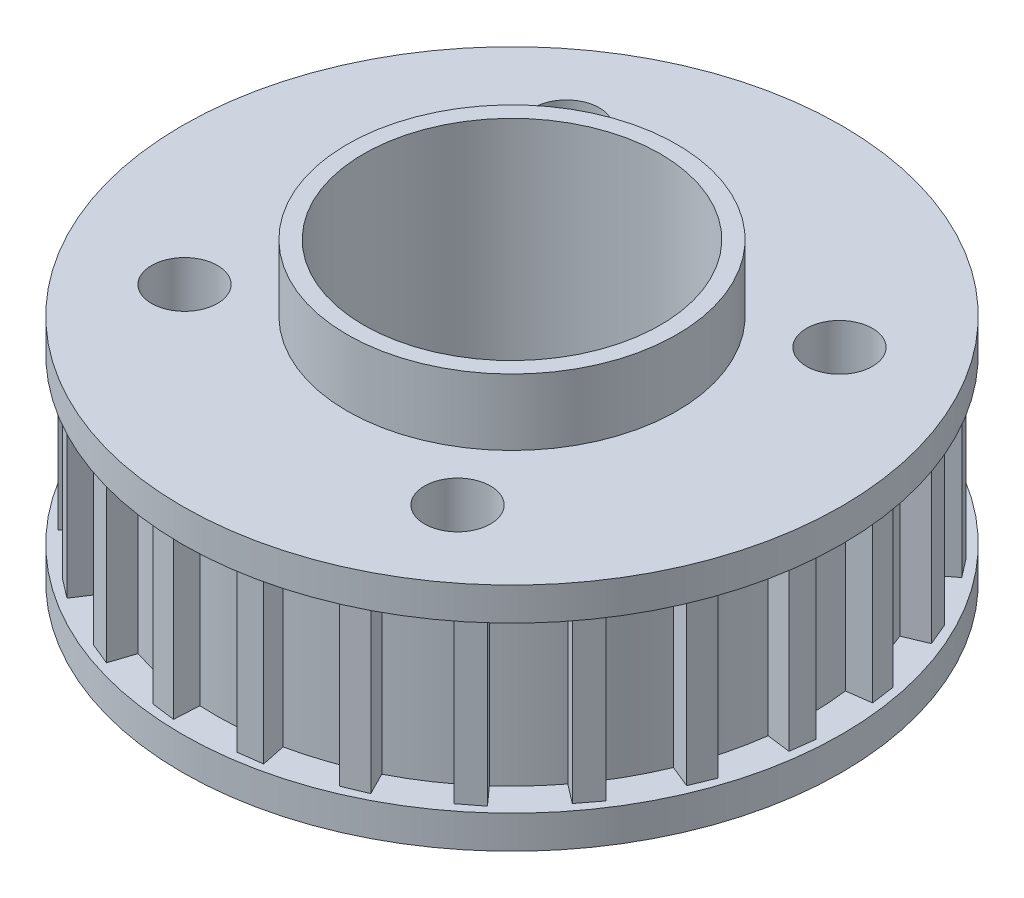
from build123d import *

# Parameters (mm, degrees)
SKETCH1_R           = 31.75
SKETCH1_R_2         = 14.2875
BOSS_EXTRUDE1_DEPTH = 3.175
SKETCH2_R           = 15.875
SKETCH2_R_2         = 14.2875
BOSS_EXTRUDE2_DEPTH = 25.4
SKETCH3_R           = 3.175
CUT_EXTRUDE1_DEPTH  = 25.4
BOSS_EXTRUDE3_START = 15.8496
SKETCH4_R           = 3.175
SKETCH4_R_2         = 15.875
BOSS_EXTRUDE3_DEPTH = 15.8496
BOSS_EXTRUDE4_START = 15.875
BOSS_EXTRUDE4_DEPTH = 15.875
BOSS_EXTRUDE5_START = 3.175
SKETCH5_R           = 31.75
SKETCH5_R_2         = 15.875
SKETCH5_R_3         = 3.175
BOSS_EXTRUDE5_DEPTH = 3.175


with BuildPart() as part:
    # Sketch1 → Boss-Extrude1 (new body)
    with BuildSketch(Plane(origin=(0, 0, 0), x_dir=(1, 0, 0), z_dir=(0, 1, 0))):
        Circle(SKETCH1_R)
        Circle(SKETCH1_R_2, mode=Mode.SUBTRACT)
    extrude(amount=BOSS_EXTRUDE1_DEPTH)

    # Sketch2 → Boss-Extrude2 (add)
    with BuildSketch(Plane(origin=(0, 3.175, 0), x_dir=(1, 0, 0), z_dir=(0, 1, 0))):
        Circle(SKETCH2_R)
        Circle(SKETCH2_R_2, mode=Mode.SUBTRACT)
    extrude(amount=BOSS_EXTRUDE2_DEPTH)

    # Sketch3 → Cut-Extrude1 (cut)
    with BuildSketch(Plane(origin=(0, 3.175, 0), x_dir=(1, 0, 0), z_dir=(0, 1, 0))):
        with Locations((-18.390705049, -13.145843594)):
            Circle(SKETCH3_R)
        with Locations((-13.145843594, 18.390705049)):
            Circle(SKETCH3_R)
        with Locations((18.390705049, 13.145843594)):
            Circle(SKETCH3_R)
        with Locations((13.145843594, -18.390705049)):
            Circle(SKETCH3_R)
    extrude(amount=-CUT_EXTRUDE1_DEPTH, mode=Mode.SUBTRACT)

    # Sketch4 → Boss-Extrude3 (add)
    with BuildSketch(Plane(origin=(0, 3.175, 0), x_dir=(1, 0, 0), z_dir=(0, 1, 0)).offset(BOSS_EXTRUDE3_START)):
        with BuildLine():
            ThreePointArc((-15.593126517, -23.927184529), (-13.286641881, -25.280840603), (-10.863650415, -26.412816089))
            ThreePointArc((-10.863650415, -26.412816089), (-9.873160958, -26.798814279), (-8.868992564, -27.147683603))
            ThreePointArc((-8.868992564, -27.147683603), (-6.290747513, -27.858252813), (-3.657340665, -28.324540832))
            ThreePointArc((-3.657340665, -28.324540832), (-2.600697634, -28.441028918), (-1.540451424, -28.518112902))
            ThreePointArc((-1.540451424, -28.518112902), (1.133850902, -28.537171132), (3.798210807, -28.305994926))
            ThreePointArc((3.798210807, -28.305994926), (4.848998935, -28.145034436), (5.893068935, -27.945079936))
            ThreePointArc((5.893068935, -27.945079936), (8.481179251, -27.271328398), (10.99492049, -26.358442244))
            ThreePointArc((10.99492049, -26.358442244), (11.96824424, -25.93100237), (12.924986385, -25.467635953))
            ThreePointArc((12.924986385, -25.467635953), (15.250529251, -24.146989701), (17.442344511, -22.614605282))
            ThreePointArc((17.442344511, -22.614605282), (18.271873478, -21.949815345), (19.076087372, -21.254614667))
            ThreePointArc((19.076087372, -21.254614667), (20.980580885, -19.377073562), (22.701101578, -17.329620342))
            ThreePointArc((22.701101578, -17.329620342), (23.330304735, -16.472784678), (23.927184529, -15.593126517))
            ThreePointArc((23.927184529, -15.593126517), (25.280840603, -13.286641881), (26.412816089, -10.863650415))
            ThreePointArc((26.412816089, -10.863650415), (26.798814279, -9.873160958), (27.147683603, -8.868992564))
            ThreePointArc((27.147683603, -8.868992564), (27.858252813, -6.290747513), (28.324540832, -3.657340665))
            ThreePointArc((28.324540832, -3.657340665), (28.441028918, -2.600697634), (28.518112902, -1.540451424))
            ThreePointArc((28.518112902, -1.540451424), (28.549292011, -0.770506171), (28.55968757, 0))
            ThreePointArc((28.55968757, 0), (28.496193829, 1.903336892), (28.305994926, 3.798210807))
            ThreePointArc((28.305994926, 3.798210807), (28.145034436, 4.848998935), (27.945079936, 5.893068935))
            ThreePointArc((27.945079936, 5.893068935), (27.271328398, 8.481179251), (26.358442244, 10.99492049))
            ThreePointArc((26.358442244, 10.99492049), (25.93100237, 11.96824424), (25.467635953, 12.924986385))
            ThreePointArc((25.467635953, 12.924986385), (24.146989701, 15.250529251), (22.614605282, 17.442344511))
            ThreePointArc((22.614605282, 17.442344511), (21.949815345, 18.271873478), (21.254614667, 19.076087372))
            ThreePointArc((21.254614667, 19.076087372), (19.377073562, 20.980580885), (17.329620342, 22.701101578))
            ThreePointArc((17.329620342, 22.701101578), (16.472784678, 23.330304735), (15.593126517, 23.927184529))
            ThreePointArc((15.593126517, 23.927184529), (13.286641881, 25.280840603), (10.863650415, 26.412816089))
            ThreePointArc((10.863650415, 26.412816089), (9.873160958, 26.798814279), (8.868992564, 27.147683603))
            ThreePointArc((8.868992564, 27.147683603), (6.290747513, 27.858252813), (3.657340665, 28.324540832))
            ThreePointArc((3.657340665, 28.324540832), (2.600697634, 28.441028918), (1.540451424, 28.518112902))
            ThreePointArc((1.540451424, 28.518112902), (-1.133850902, 28.537171132), (-3.798210807, 28.305994926))
            ThreePointArc((-3.798210807, 28.305994926), (-4.848998935, 28.145034436), (-5.893068935, 27.945079936))
            ThreePointArc((-5.893068935, 27.945079936), (-8.481179251, 27.271328398), (-10.99492049, 26.358442244))
            ThreePointArc((-10.99492049, 26.358442244), (-11.96824424, 25.93100237), (-12.924986385, 25.467635953))
            ThreePointArc((-12.924986385, 25.467635953), (-15.250529251, 24.146989701), (-17.442344511, 22.614605282))
            ThreePointArc((-17.442344511, 22.614605282), (-18.271873478, 21.949815345), (-19.076087372, 21.254614667))
            ThreePointArc((-19.076087372, 21.254614667), (-20.980580885, 19.377073562), (-22.701101578, 17.329620342))
            ThreePointArc((-22.701101578, 17.329620342), (-23.330304735, 16.472784678), (-23.927184529, 15.593126517))
            ThreePointArc((-23.927184529, 15.593126517), (-25.280840603, 13.286641881), (-26.412816089, 10.863650415))
            ThreePointArc((-26.412816089, 10.863650415), (-26.798814279, 9.873160958), (-27.147683603, 8.868992564))
            ThreePointArc((-27.147683603, 8.868992564), (-27.858252813, 6.290747513), (-28.324540832, 3.657340665))
            ThreePointArc((-28.324540832, 3.657340665), (-28.441028918, 2.600697634), (-28.518112902, 1.540451424))
            ThreePointArc((-28.518112902, 1.540451424), (-28.537171132, -1.133850902), (-28.305994926, -3.798210807))
            ThreePointArc((-28.305994926, -3.798210807), (-28.145034436, -4.848998935), (-27.945079936, -5.893068935))
            ThreePointArc((-27.945079936, -5.893068935), (-27.271328398, -8.481179251), (-26.358442244, -10.99492049))
            ThreePointArc((-26.358442244, -10.99492049), (-25.93100237, -11.96824424), (-25.467635953, -12.924986385))
            ThreePointArc((-25.467635953, -12.924986385), (-24.146989701, -15.250529251), (-22.614605282, -17.442344511))
            ThreePointArc((-22.614605282, -17.442344511), (-21.949815345, -18.271873478), (-21.254614667, -19.076087372))
            ThreePointArc((-21.254614667, -19.076087372), (-19.377073562, -20.980580885), (-17.329620342, -22.701101578))
            ThreePointArc((-17.329620342, -22.701101578), (-16.472784678, -23.330304735), (-15.593126517, -23.927184529))
        make_face()
        with Locations((-18.390705049, -13.145843594)):
            Circle(SKETCH4_R, mode=Mode.SUBTRACT)
        with Locations((13.145843594, -18.390705049)):
            Circle(SKETCH4_R, mode=Mode.SUBTRACT)
        Circle(SKETCH4_R_2, mode=Mode.SUBTRACT)
        with Locations((-13.145843594, 18.390705049)):
            Circle(SKETCH4_R, mode=Mode.SUBTRACT)
        with Locations((18.390705049, 13.145843594)):
            Circle(SKETCH4_R, mode=Mode.SUBTRACT)
    extrude(amount=-BOSS_EXTRUDE3_DEPTH)

    # Sketch4<9> → Boss-Extrude4 (add)
    with BuildSketch(Plane(origin=(0, 3.175, 0), x_dir=(1, 0, 0), z_dir=(0, 1, 0)).offset(BOSS_EXTRUDE4_START)):
        with BuildLine():
            ThreePointArc((-8.868992564, -27.147683603), (-9.873160958, -26.798814279), (-10.863650415, -26.412816089))
            Line((-10.863650415, -26.412816089), (-11.746663464, -28.55968757))
            Line((-11.746663464, -28.55968757), (-9.616514462, -29.435822625))
            Line((-9.616514462, -29.435822625), (-8.868992564, -27.147683603))
        make_face()
        with BuildLine():
            Line((-16.907391181, -25.943884202), (-15.593126517, -23.927184529))
            ThreePointArc((-15.593126517, -23.927184529), (-16.472784678, -23.330304735), (-17.329620342, -22.701101578))
            Line((-17.329620342, -22.701101578), (-18.738196677, -24.546279594))
            Line((-18.738196677, -24.546279594), (-16.907391181, -25.943884202))
        make_face()
        with BuildLine():
            ThreePointArc((-1.540451424, -28.518112902), (-2.600697634, -28.441028918), (-3.657340665, -28.324540832))
            Line((-3.657340665, -28.324540832), (-3.954614547, -30.626800035))
            Line((-3.954614547, -30.626800035), (-1.670288174, -30.921758382))
            Line((-1.670288174, -30.921758382), (-1.540451424, -28.518112902))
        make_face()
        with BuildLine():
            Line((-23.046057132, -20.683912944), (-21.254614667, -19.076087372))
            ThreePointArc((-21.254614667, -19.076087372), (-21.949815345, -18.271873478), (-22.614605282, -17.442344511))
            Line((-22.614605282, -17.442344511), (-24.452752754, -18.860083228))
            Line((-24.452752754, -18.860083228), (-23.046057132, -20.683912944))
        make_face()
        with BuildLine():
            ThreePointArc((5.893068935, -27.945079936), (4.848998935, -28.145034436), (3.798210807, -28.305994926))
            Line((3.798210807, -28.305994926), (4.106934816, -30.606746691))
            Line((4.106934816, -30.606746691), (6.389765493, -30.300427406))
            Line((6.389765493, -30.300427406), (5.893068935, -27.945079936))
        make_face()
        with BuildLine():
            Line((-27.614172375, -14.014367201), (-25.467635953, -12.924986385))
            ThreePointArc((-25.467635953, -12.924986385), (-25.93100237, -11.96824424), (-26.358442244, -10.99492049))
            Line((-26.358442244, -10.99492049), (-28.500894141, -11.888603358))
            Line((-28.500894141, -11.888603358), (-27.614172375, -14.014367201))
        make_face()
        with BuildLine():
            ThreePointArc((12.924986385, -25.467635953), (11.96824424, -25.93100237), (10.99492049, -26.358442244))
            Line((10.99492049, -26.358442244), (11.888603358, -28.500894141))
            Line((11.888603358, -28.500894141), (14.014367201, -27.614172375))
            Line((14.014367201, -27.614172375), (12.924986385, -25.467635953))
        make_face()
        with BuildLine():
            Line((-30.300427406, -6.389765493), (-27.945079936, -5.893068935))
            ThreePointArc((-27.945079936, -5.893068935), (-28.145034436, -4.848998935), (-28.305994926, -3.798210807))
            Line((-28.305994926, -3.798210807), (-30.606746691, -4.106934816))
            Line((-30.606746691, -4.106934816), (-30.300427406, -6.389765493))
        make_face()
        with BuildLine():
            ThreePointArc((19.076087372, -21.254614667), (18.271873478, -21.949815345), (17.442344511, -22.614605282))
            Line((17.442344511, -22.614605282), (18.860083228, -24.452752754))
            Line((18.860083228, -24.452752754), (20.683912944, -23.046057132))
            Line((20.683912944, -23.046057132), (19.076087372, -21.254614667))
        make_face()
        with BuildLine():
            Line((-30.921758382, 1.670288174), (-28.518112902, 1.540451424))
            ThreePointArc((-28.518112902, 1.540451424), (-28.441028918, 2.600697634), (-28.324540832, 3.657340665))
            Line((-28.324540832, 3.657340665), (-30.626800035, 3.954614547))
            Line((-30.626800035, 3.954614547), (-30.921758382, 1.670288174))
        make_face()
        with BuildLine():
            ThreePointArc((23.927184529, -15.593126517), (23.330304735, -16.472784678), (22.701101578, -17.329620342))
            Line((22.701101578, -17.329620342), (24.546279594, -18.738196677))
            Line((24.546279594, -18.738196677), (25.943884202, -16.907391181))
            Line((25.943884202, -16.907391181), (23.927184529, -15.593126517))
        make_face()
        with BuildLine():
            Line((-29.435822625, 9.616514462), (-27.147683603, 8.868992564))
            ThreePointArc((-27.147683603, 8.868992564), (-26.798814279, 9.873160958), (-26.412816089, 10.863650415))
            Line((-26.412816089, 10.863650415), (-28.55968757, 11.746663464))
            Line((-28.55968757, 11.746663464), (-29.435822625, 9.616514462))
        make_face()
        with BuildLine():
            ThreePointArc((27.147683603, -8.868992564), (26.798814279, -9.873160958), (26.412816089, -10.863650415))
            Line((26.412816089, -10.863650415), (28.55968757, -11.746663464))
            Line((28.55968757, -11.746663464), (29.435822625, -9.616514462))
            Line((29.435822625, -9.616514462), (27.147683603, -8.868992564))
        make_face()
        with BuildLine():
            Line((-25.943884202, 16.907391181), (-23.927184529, 15.593126517))
            ThreePointArc((-23.927184529, 15.593126517), (-23.330304735, 16.472784678), (-22.701101578, 17.329620342))
            Line((-22.701101578, 17.329620342), (-24.546279594, 18.738196677))
            Line((-24.546279594, 18.738196677), (-25.943884202, 16.907391181))
        make_face()
        with BuildLine():
            ThreePointArc((28.518112902, -1.540451424), (28.441028918, -2.600697634), (28.324540832, -3.657340665))
            Line((28.324540832, -3.657340665), (30.626800035, -3.954614547))
            Line((30.626800035, -3.954614547), (30.921758382, -1.670288174))
            Line((30.921758382, -1.670288174), (28.518112902, -1.540451424))
        make_face()
        with BuildLine():
            Line((-20.683912944, 23.046057132), (-19.076087372, 21.254614667))
            ThreePointArc((-19.076087372, 21.254614667), (-18.271873478, 21.949815345), (-17.442344511, 22.614605282))
            Line((-17.442344511, 22.614605282), (-18.860083228, 24.452752754))
            Line((-18.860083228, 24.452752754), (-20.683912944, 23.046057132))
        make_face()
        with BuildLine():
            Line((-14.014367201, 27.614172375), (-12.924986385, 25.467635953))
            ThreePointArc((-12.924986385, 25.467635953), (-11.96824424, 25.93100237), (-10.99492049, 26.358442244))
            Line((-10.99492049, 26.358442244), (-11.888603358, 28.500894141))
            Line((-11.888603358, 28.500894141), (-14.014367201, 27.614172375))
        make_face()
        with BuildLine():
            ThreePointArc((27.945079936, 5.893068935), (28.145034436, 4.848998935), (28.305994926, 3.798210807))
            Line((28.305994926, 3.798210807), (30.606746691, 4.106934816))
            Line((30.606746691, 4.106934816), (30.300427406, 6.389765493))
            Line((30.300427406, 6.389765493), (27.945079936, 5.893068935))
        make_face()
        with BuildLine():
            Line((-6.389765493, 30.300427406), (-5.893068935, 27.945079936))
            ThreePointArc((-5.893068935, 27.945079936), (-4.848998935, 28.145034436), (-3.798210807, 28.305994926))
            Line((-3.798210807, 28.305994926), (-4.106934816, 30.606746691))
            Line((-4.106934816, 30.606746691), (-6.389765493, 30.300427406))
        make_face()
        with BuildLine():
            ThreePointArc((25.467635953, 12.924986385), (25.93100237, 11.96824424), (26.358442244, 10.99492049))
            Line((26.358442244, 10.99492049), (28.500894141, 11.888603358))
            Line((28.500894141, 11.888603358), (27.614172375, 14.014367201))
            Line((27.614172375, 14.014367201), (25.467635953, 12.924986385))
        make_face()
        with BuildLine():
            Line((1.670288174, 30.921758382), (1.540451424, 28.518112902))
            ThreePointArc((1.540451424, 28.518112902), (2.600697634, 28.441028918), (3.657340665, 28.324540832))
            Line((3.657340665, 28.324540832), (3.954614547, 30.626800035))
            Line((3.954614547, 30.626800035), (1.670288174, 30.921758382))
        make_face()
        with BuildLine():
            ThreePointArc((21.254614667, 19.076087372), (21.949815345, 18.271873478), (22.614605282, 17.442344511))
            Line((22.614605282, 17.442344511), (24.452752754, 18.860083228))
            Line((24.452752754, 18.860083228), (23.046057132, 20.683912944))
            Line((23.046057132, 20.683912944), (21.254614667, 19.076087372))
        make_face()
        with BuildLine():
            Line((9.616514462, 29.435822625), (8.868992564, 27.147683603))
            ThreePointArc((8.868992564, 27.147683603), (9.873160958, 26.798814279), (10.863650415, 26.412816089))
            Line((10.863650415, 26.412816089), (11.746663464, 28.55968757))
            Line((11.746663464, 28.55968757), (9.616514462, 29.435822625))
        make_face()
        with BuildLine():
            ThreePointArc((15.593126517, 23.927184529), (16.472784678, 23.330304735), (17.329620342, 22.701101578))
            Line((17.329620342, 22.701101578), (18.738196677, 24.546279594))
            Line((18.738196677, 24.546279594), (16.907391181, 25.943884202))
            Line((16.907391181, 25.943884202), (15.593126517, 23.927184529))
        make_face()
    extrude(amount=-BOSS_EXTRUDE4_DEPTH)

    # Sketch5 → Boss-Extrude5 (add)
    with BuildSketch(Plane(origin=(0, 19.0246, 0), x_dir=(1, 0, 0), z_dir=(0, 1, 0)).offset(BOSS_EXTRUDE5_START)):
        Circle(SKETCH5_R)
        Circle(SKETCH5_R_2, mode=Mode.SUBTRACT)
        with Locations((13.145843594, -18.390705049)):
            Circle(SKETCH5_R_3, mode=Mode.SUBTRACT)
        with Locations((-18.390705049, -13.145843594)):
            Circle(SKETCH5_R_3, mode=Mode.SUBTRACT)
        with Locations((-13.145843594, 18.390705049)):
            Circle(SKETCH5_R_3, mode=Mode.SUBTRACT)
        with Locations((18.390705049, 13.145843594)):
            Circle(SKETCH5_R_3, mode=Mode.SUBTRACT)
    extrude(amount=-BOSS_EXTRUDE5_DEPTH)


solid = part.part
